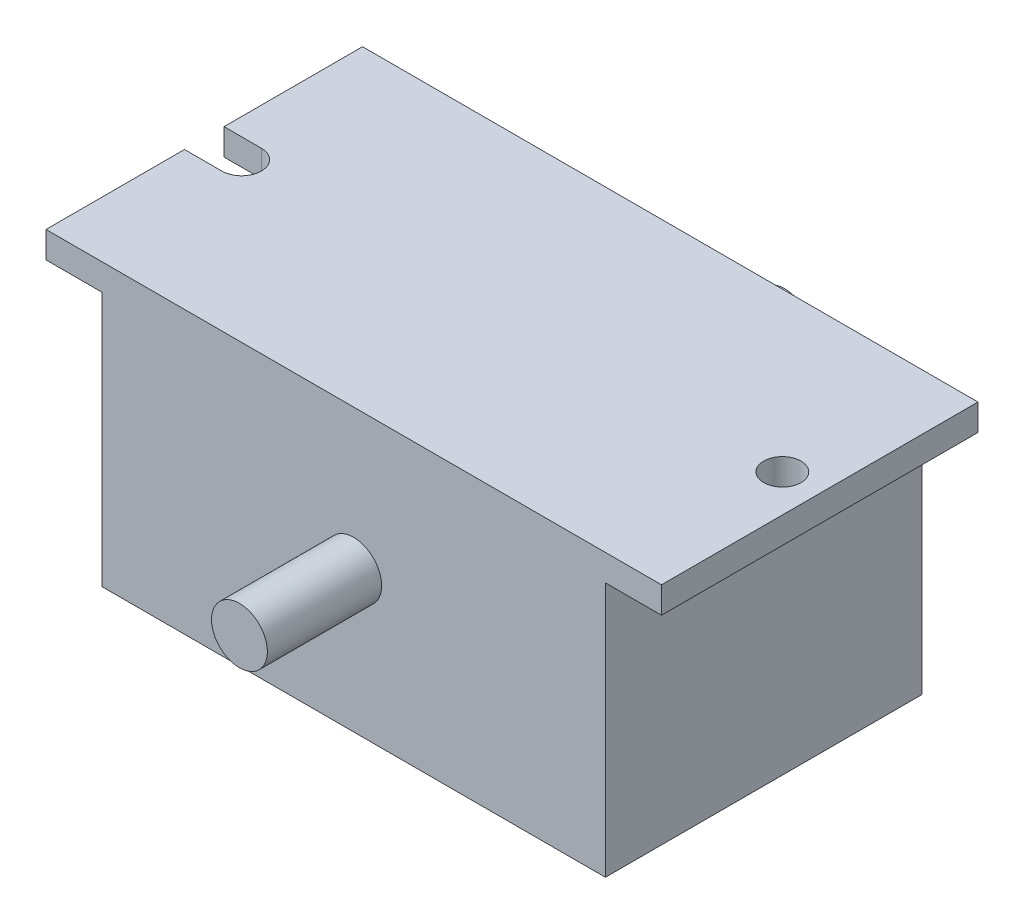
from build123d import *

# Parameters (mm, degrees)
BOSS_EXTRUDE1_DEPTH = 72
SKETCH2_R           = 4.25
CUT_EXTRUDE1_DEPTH  = 120.079805173
SKETCH3_R           = 6.35
BOSS_EXTRUDE2_DEPTH = 26
BOSS_EXTRUDE3_START = 26
SKETCH5_R           = 6.35
BOSS_EXTRUDE3_DEPTH = 26


with BuildPart() as part:
    # Sketch1 → Boss-Extrude1 (new body)
    with BuildSketch(Plane.XY):
        Polygon((-57.25, 32), (57.25, 32), (70, 32), (70, 26), (57.25, 26), (57.25, -32), (-57.25, -32), (-57.25, 26), (-70, 26), (-70, 32), align=None)
    extrude(amount=BOSS_EXTRUDE1_DEPTH)

    # Sketch2 → Cut-Extrude1 (cut, through all)
    with BuildSketch(Plane(origin=(0, 32, 0), x_dir=(1, 0, 0), z_dir=(0, 1, 0))):
        with Locations(Location((61.5, -36, 0), (0, 0, 180))):
            Circle(SKETCH2_R)
        with BuildLine():
            Line((-61.5, -31.5), (-70, -31.5))
            Line((-70, -31.5), (-70, -40.5))
            Line((-70, -40.5), (-61.5, -40.5))
            ThreePointArc((-61.5, -40.5), (-57, -36), (-61.5, -31.5))
        make_face()
    extrude(amount=-CUT_EXTRUDE1_DEPTH, mode=Mode.SUBTRACT)

    # Sketch3 → Boss-Extrude2 (add)
    with BuildSketch(Plane.XY.offset(72)):
        with Locations(Location((0, 0, 0), (0, 0, 180))):
            Circle(SKETCH3_R)
    extrude(amount=BOSS_EXTRUDE2_DEPTH)

    # Sketch5 → Boss-Extrude3 (add)
    with BuildSketch(Plane(origin=(0, 0, 0), x_dir=(-1, 0, 0), z_dir=(0, 0, -1)).offset(BOSS_EXTRUDE3_START)):
        Circle(SKETCH5_R)
    extrude(amount=-BOSS_EXTRUDE3_DEPTH)


solid = part.part
